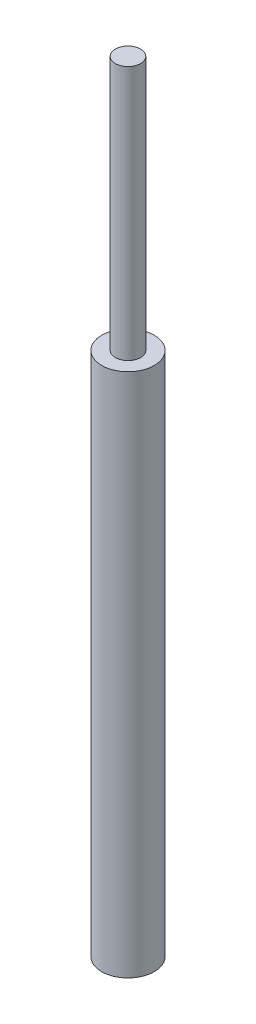
from build123d import *

# Parameters (mm, degrees)
SKETCH1_R           = 5
BOSS_EXTRUDE1_DEPTH = 50
SKETCH2_R           = 2.4
BOSS_EXTRUDE2_DEPTH = 1.5
SKETCH3_R           = 2.4
BOSS_EXTRUDE3_DEPTH = 47


with BuildPart() as part:
    # Sketch1 → Boss-Extrude1 (new, symmetric)
    with BuildSketch(Plane(origin=(0, 0, 0), x_dir=(1, 0, 0), z_dir=(0, 1, 0))):
        with Locations(Location((0, 0, 0), (0, 0, 270))):
            Circle(SKETCH1_R)
    extrude(amount=BOSS_EXTRUDE1_DEPTH, both=True)

    # Sketch2 → Boss-Extrude2 (add, symmetric)
    with BuildSketch(Plane(origin=(0, 50, 0), x_dir=(1, 0, 0), z_dir=(0, 1, 0))):
        with Locations(Location((0, 0, 0), (0, 0, 270))):
            Circle(SKETCH2_R)
    boss_extrude2 = extrude(amount=BOSS_EXTRUDE2_DEPTH, both=True)

    # Mirror1: Boss-Extrude2 across plane
    add(boss_extrude2.mirror(Plane.ZX))

    # Sketch3 → Boss-Extrude3 (add)
    with BuildSketch(Plane(origin=(0, 51.5, 0), x_dir=(1, 0, 0), z_dir=(0, 1, 0))):
        with Locations(Location((0, 0, 0), (0, 0, 270))):
            Circle(SKETCH3_R)
    extrude(amount=BOSS_EXTRUDE3_DEPTH)


solid = part.part
